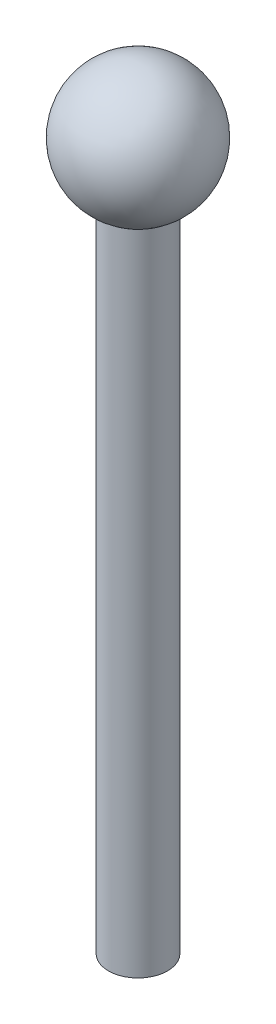
from build123d import *


with BuildPart() as part:
    # Esquisse1 → Révolution1 (revolve)
    with BuildSketch(Plane.XY, mode=Mode.PRIVATE) as r_volution1_sk:
        with BuildLine():
            Line((0, 0), (-4.556539773, 0))
            Line((-4.556539773, 0), (-4.556539773, 100))
            ThreePointArc((-4.556539773, 100), (-9.721514754, 111.245103669), (0, 118.901569822))
            Line((0, 118.901569822), (0, 0))
        make_face()
    revolve(r_volution1_sk.sketch.rotate(Axis((0, 0, 0), (0, 1, 0)), 180), axis=Axis((0, 0, 0), (0, 1, 0)))


solid = part.part
